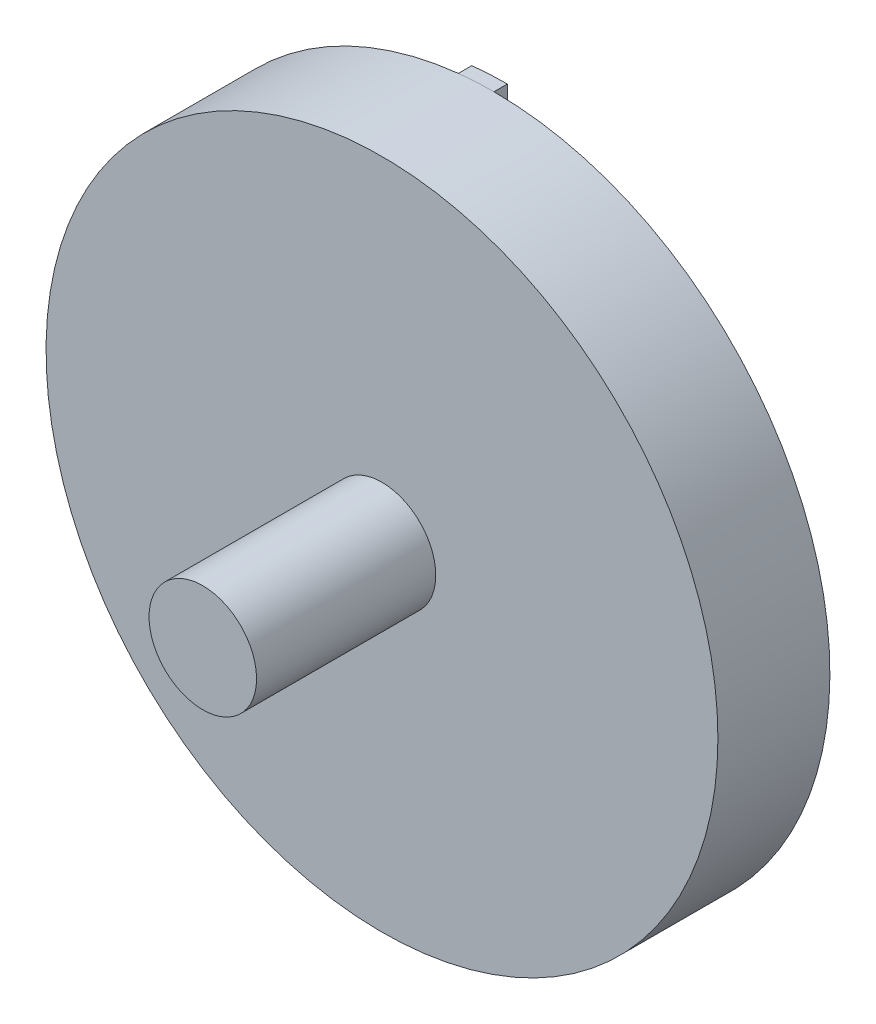
from build123d import *

# Parameters (mm, degrees)
SKETCH1_R           = 75
BOSS_EXTRUDE1_DEPTH = 25
SKETCH2_R           = 12
BOSS_EXTRUDE2_DEPTH = 40
BOSS_EXTRUDE3_DEPTH = 3


with BuildPart() as part:
    # Sketch1 → Boss-Extrude1 (new body)
    with BuildSketch(Plane.XY):
        Circle(SKETCH1_R)
    extrude(amount=BOSS_EXTRUDE1_DEPTH)

    # Sketch2 → Boss-Extrude2 (add)
    with BuildSketch(Plane.XY.offset(25)):
        Circle(SKETCH2_R)
    extrude(amount=BOSS_EXTRUDE2_DEPTH)

    # Sketch3 → Boss-Extrude3 (add)
    with BuildSketch(Plane(origin=(0, 0, 0), x_dir=(-1, 0, 0), z_dir=(0, 0, -1))):
        with BuildLine():
            Line((0, 0), (0, 75))
            add(Edge.make_bspline(
                [(7.949037258, 74.577562354), (3.986254227, 74.999822237), (0, 75)],
                knots=[0, 0, 0, 1, 1, 1], degree=2))
            Line((7.949037258, 74.577562354), (7.949037258, 0))
            Line((7.949037258, 0), (0, 0))
        make_face()
    extrude(amount=BOSS_EXTRUDE3_DEPTH)


solid = part.part
